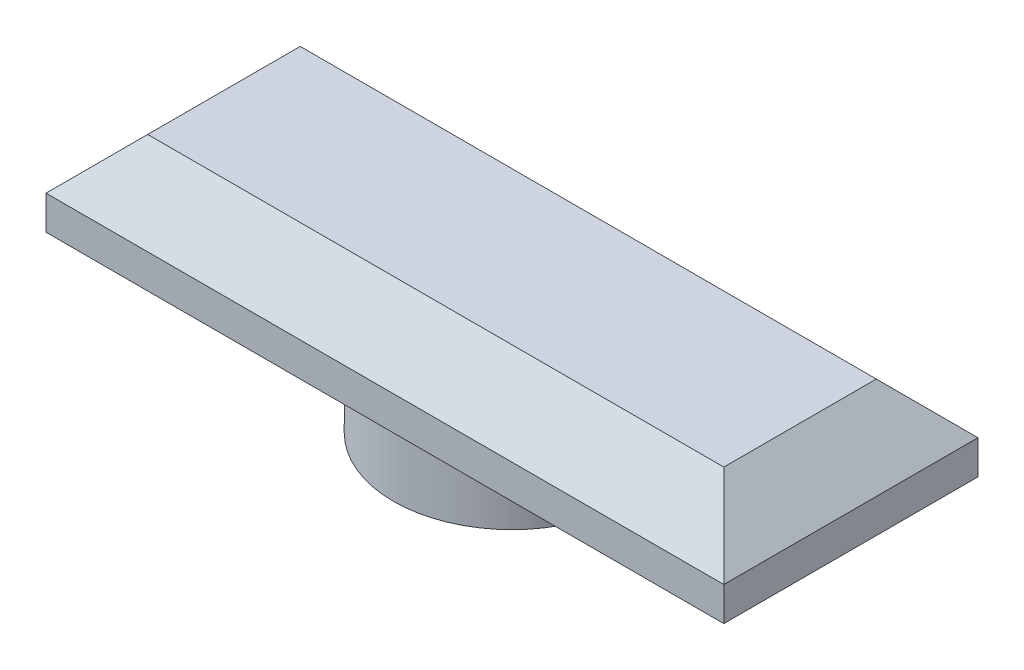
from build123d import *

# Parameters (mm, degrees)
SKETCH2_W           = 40
SKETCH2_H           = 15
BOSS_EXTRUDE2_DEPTH = 5
CHAMFER1_SIZE       = 3
SKETCH5_R           = 7
SKETCH5_R_2         = 6
BOSS_EXTRUDE4_DEPTH = 4


with BuildPart() as part:
    # Sketch2 → Boss-Extrude2 (new body)
    with BuildSketch(Plane(origin=(0, 4, 0), x_dir=(1, 0, 0), z_dir=(0, 1, 0))):
        Rectangle(SKETCH2_W, SKETCH2_H)
    extrude(amount=BOSS_EXTRUDE2_DEPTH)

    # Chamfer1
    chamfer1_edges = [part.edges().sort_by_distance(p)[0] for p in [
        (-20, 9, 0),
        (0, 9, 7.5),
        (20, 9, 0),
        (0, 9, -7.5),
    ]]
    chamfer(chamfer1_edges, length=CHAMFER1_SIZE)

    # Sketch5 → Boss-Extrude4 (add)
    with BuildSketch(Plane(origin=(0, 4, 0), x_dir=(-1, 0, 0), z_dir=(0, -1, 0))):
        with Locations(Location((0, 0, 0), (0, 0, 270))):
            Circle(SKETCH5_R)
        with Locations(Location((0, 0, 0), (0, 0, 90))):
            Circle(SKETCH5_R_2, mode=Mode.SUBTRACT)
    extrude(amount=BOSS_EXTRUDE4_DEPTH)


solid = part.part
